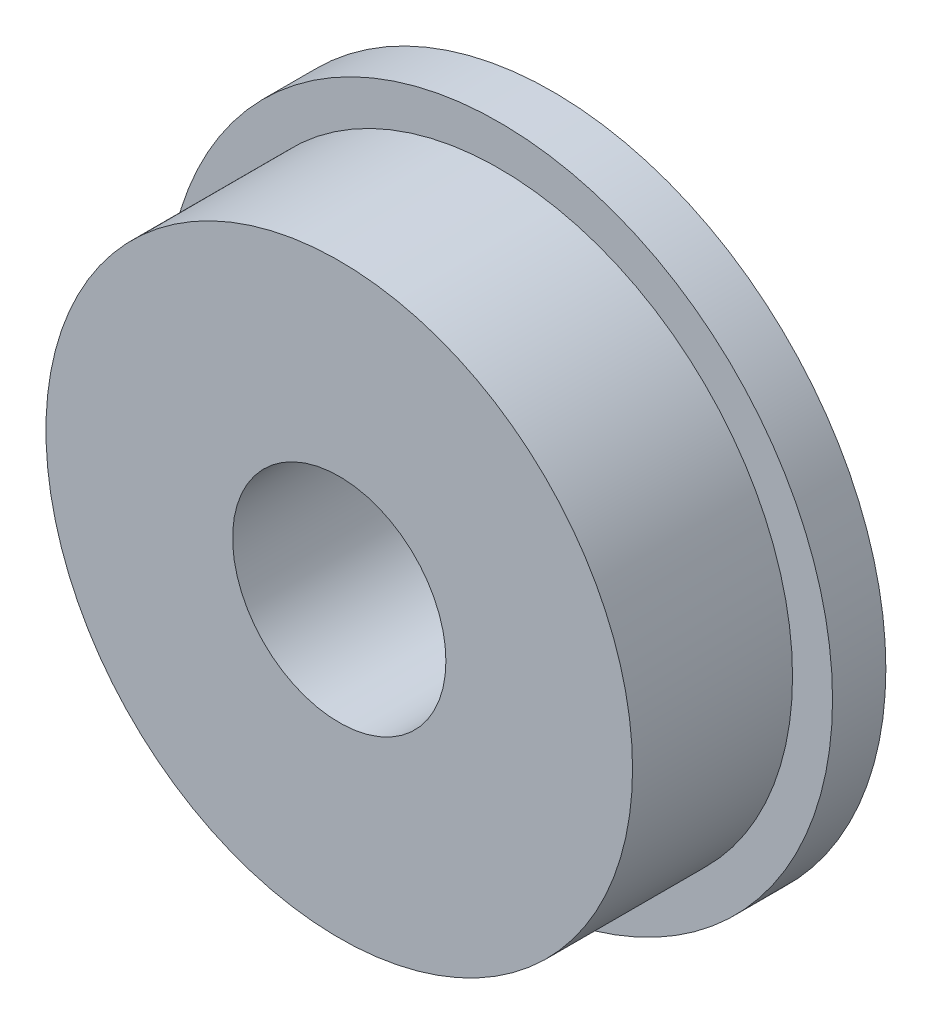
from build123d import *

# Parameters (mm, degrees)
SKETCH_1_R          = 6.25
SKETCH_1_R_2        = 2
EXTRUDE_1_DEPTH     = 4
CUT_EXTRUDE_START   = -3
SKETCH_2_R          = 6.25
SKETCH_2_R_2        = 5.5
CUT_EXTRUDE_1_DEPTH = 3


with BuildPart() as part:
    # 草图1 → 凸台-拉伸1 (new body)
    with BuildSketch(Plane.XY):
        Circle(SKETCH_1_R)
        Circle(SKETCH_1_R_2, mode=Mode.SUBTRACT)
    extrude(amount=EXTRUDE_1_DEPTH)

    # 草图2 → 切除-拉伸1 (cut)
    with BuildSketch(Plane.XY.offset(4).offset(CUT_EXTRUDE_START)):
        Circle(SKETCH_2_R)
        Circle(SKETCH_2_R_2, mode=Mode.SUBTRACT)
    extrude(amount=CUT_EXTRUDE_1_DEPTH, mode=Mode.SUBTRACT)


solid = part.part
